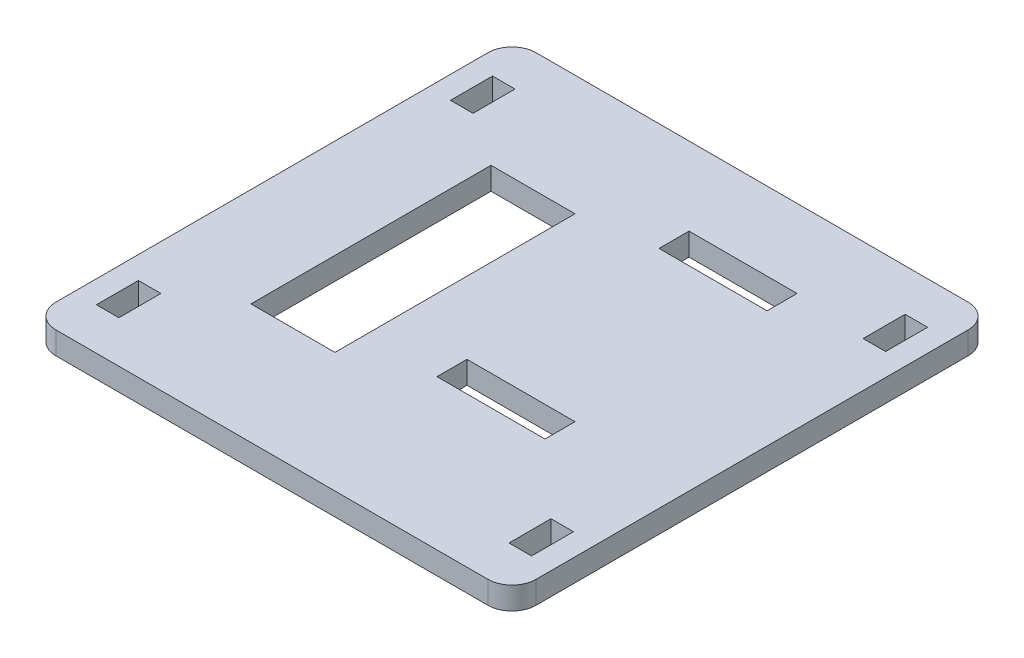
from build123d import *

# Parameters (mm, degrees)
SKETCH1_W           = 101.6
SKETCH1_H           = 101.6
SKETCH1_W_2         = 4.7625
SKETCH1_H_2         = 8.89
SKETCH1_W_3         = 17.78
SKETCH1_H_3         = 50.8
SKETCH1_W_4         = 22.86
SKETCH1_H_4         = 6.35
BOSS_EXTRUDE1_DEPTH = 4.7625
FILLET1_R           = 5.08


with BuildPart() as part:
    # Sketch1 → Boss-Extrude1 (new body)
    with BuildSketch(Plane(origin=(0, 0, 0), x_dir=(1, 0, 0), z_dir=(0, 1, 0))):
        with Locations((-50.8, 50.8)):
            Rectangle(SKETCH1_W, SKETCH1_H)
        with Locations((-94.45625, 13.335)):
            Rectangle(SKETCH1_W_2, SKETCH1_H_2, mode=Mode.SUBTRACT)
        with Locations((-94.45625, 88.265)):
            Rectangle(SKETCH1_W_2, SKETCH1_H_2, mode=Mode.SUBTRACT)
        with Locations((-71.755, 50.8)):
            Rectangle(SKETCH1_W_3, SKETCH1_H_3, mode=Mode.SUBTRACT)
        with Locations((-36.195, 81.915)):
            Rectangle(SKETCH1_W_4, SKETCH1_H_4, mode=Mode.SUBTRACT)
        with Locations((-7.14375, 13.335)):
            Rectangle(SKETCH1_W_2, SKETCH1_H_2, mode=Mode.SUBTRACT)
        with Locations((-7.14375, 88.265)):
            Rectangle(SKETCH1_W_2, SKETCH1_H_2, mode=Mode.SUBTRACT)
        with Locations((-36.195, 34.925)):
            Rectangle(SKETCH1_W_4, SKETCH1_H_4, mode=Mode.SUBTRACT)
    extrude(amount=BOSS_EXTRUDE1_DEPTH)

    # Fillet1
    fillet1_edges = [part.edges().sort_by_distance(p)[0] for p in [
        (0, 2.38125, 0),
        (-101.6, 2.38125, 0),
        (-101.6, 2.38125, -101.6),
        (0, 2.38125, -101.6),
    ]]
    fillet(fillet1_edges, radius=FILLET1_R)


solid = part.part
